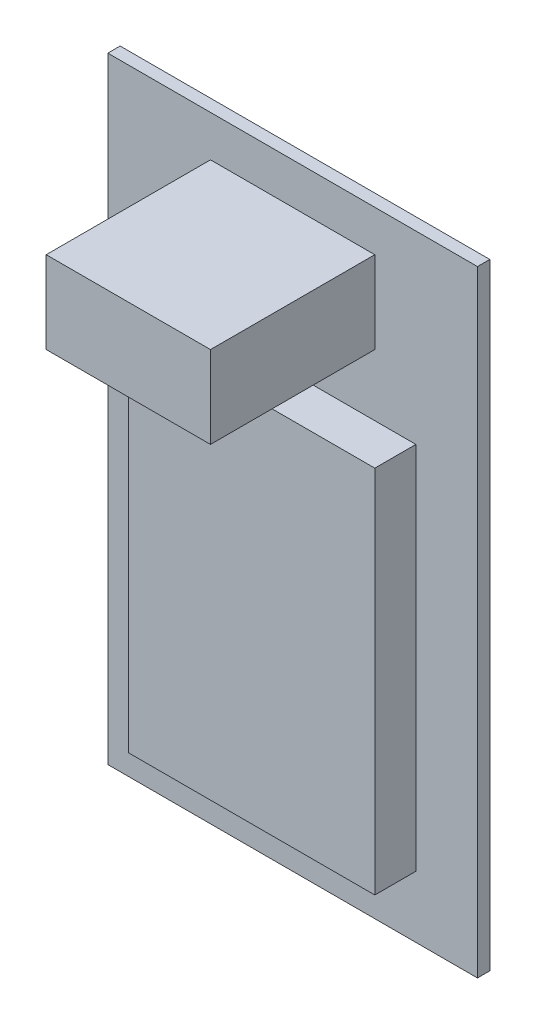
from build123d import *

# Parameters (mm, degrees)
SKETCH2_W           = 150
SKETCH2_H           = 90
BOSS_EXTRUDE1_DEPTH = 3
SKETCH3_W           = 60
SKETCH3_H           = 90
BOSS_EXTRUDE2_DEPTH = 10
SKETCH4_W           = 40
SKETCH4_H           = 20
BOSS_EXTRUDE3_DEPTH = 40


with BuildPart() as part:
    # Sketch2 → Boss-Extrude1 (new body)
    with BuildSketch(Plane(origin=(0, 0, 0), x_dir=(0, 1, 0), z_dir=(0, 0, 1))):
        with Locations((75, 45)):
            Rectangle(SKETCH2_W, SKETCH2_H)
    extrude(amount=BOSS_EXTRUDE1_DEPTH)

    # Sketch3 → Boss-Extrude2 (add)
    with BuildSketch(Plane.XY.offset(3)):
        with Locations((-45, 60)):
            Rectangle(SKETCH3_W, SKETCH3_H)
    extrude(amount=BOSS_EXTRUDE2_DEPTH)

    # Sketch4 → Boss-Extrude3 (add)
    with BuildSketch(Plane.XY.offset(3)):
        with Locations((-45, 130)):
            Rectangle(SKETCH4_W, SKETCH4_H)
    extrude(amount=BOSS_EXTRUDE3_DEPTH)


solid = part.part
